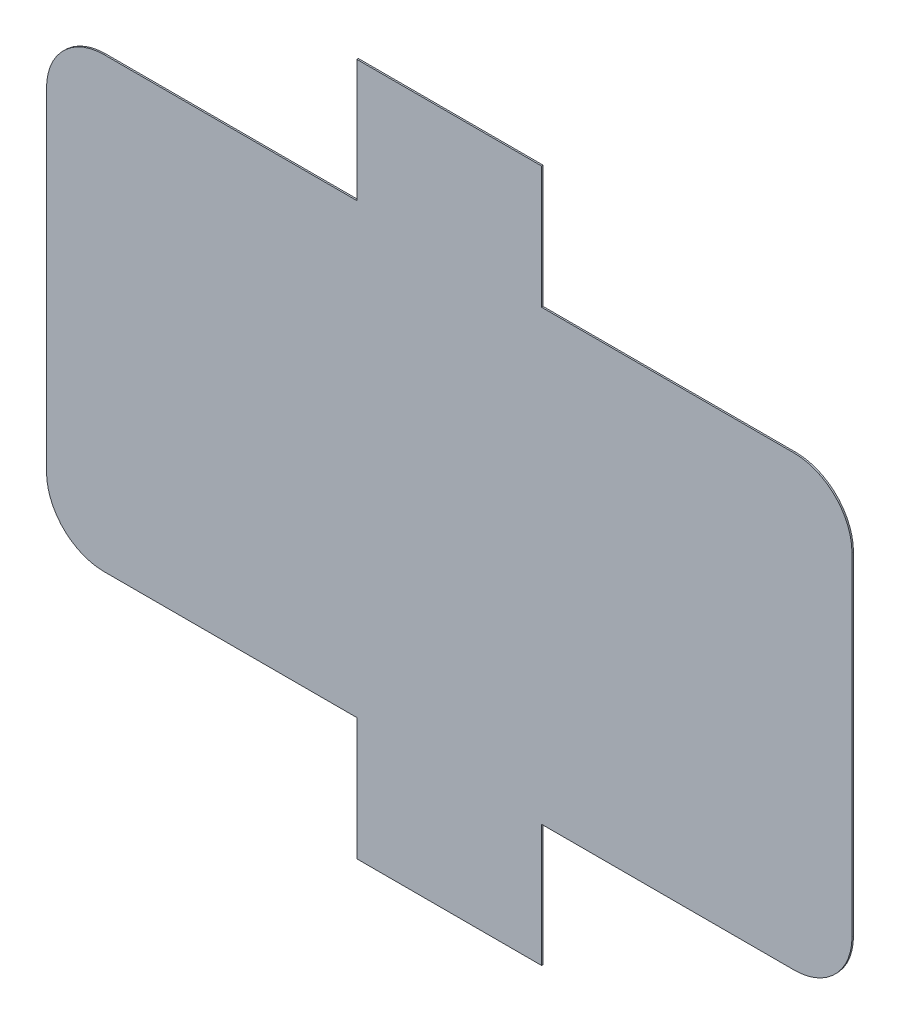
from build123d import *

# Parameters (mm, degrees)
SKETCH_1_W          = 76
SKETCH_1_H          = 60
EXTRUDE_1_DEPTH     = 0.13
SKETCH_2_W          = 30
SKETCH_2_H          = 10
CUT_EXTRUDE_1_DEPTH = 49.41504828
CUT_EXTRUDE_2_DEPTH = 49.41504828


with BuildPart() as part:
    # 草圖1 → 填料-伸長1 (new body)
    with BuildSketch(Plane.XY):
        Rectangle(SKETCH_1_W, SKETCH_1_H)
    extrude(amount=EXTRUDE_1_DEPTH)

    # 草圖2 → 除料-伸長1 (cut, through all)
    with BuildSketch(Plane.XY.offset(0.13)):
        with Locations((-23, 25)):
            Rectangle(SKETCH_2_W, SKETCH_2_H)
        with Locations((23, 25)):
            Rectangle(SKETCH_2_W, SKETCH_2_H)
        with Locations((23, -25)):
            Rectangle(SKETCH_2_W, SKETCH_2_H)
        with Locations((-23, -25)):
            Rectangle(SKETCH_2_W, SKETCH_2_H)
    extrude(amount=-CUT_EXTRUDE_1_DEPTH, mode=Mode.SUBTRACT)

    # 草圖3 → 除料-伸長2 (cut, through all)
    with BuildSketch(Plane.XY.offset(0.13)):
        with BuildLine():
            Line((-8, 19.4), (-29.9, 19.4))
            ThreePointArc((-29.9, 19.4), (-33.435533906, 17.935533906), (-34.9, 14.4))
            Line((-34.9, 14.4), (-34.9, -14.4))
            ThreePointArc((-34.9, -14.4), (-33.435533906, -17.935533906), (-29.9, -19.4))
            Line((-29.9, -19.4), (-8, -19.4))
            Line((-8, -19.4), (-8, -20))
            Line((-8, -20), (-38, -20))
            Line((-38, -20), (-38, 20))
            Line((-38, 20), (-8, 20))
            Line((-8, 20), (-8, 19.4))
        make_face()
        with BuildLine():
            Line((8, -20), (8, -19.4))
            Line((8, -19.4), (29.9, -19.4))
            ThreePointArc((29.9, -19.4), (33.435533906, -17.935533906), (34.9, -14.4))
            Line((34.9, -14.4), (34.9, 14.4))
            ThreePointArc((34.9, 14.4), (33.435533906, 17.935533906), (29.9, 19.4))
            Line((29.9, 19.4), (8, 19.4))
            Line((8, 19.4), (8, 20))
            Line((8, 20), (38, 20))
            Line((38, 20), (38, -20))
            Line((38, -20), (8, -20))
        make_face()
    extrude(amount=-CUT_EXTRUDE_2_DEPTH, mode=Mode.SUBTRACT)


solid = part.part
